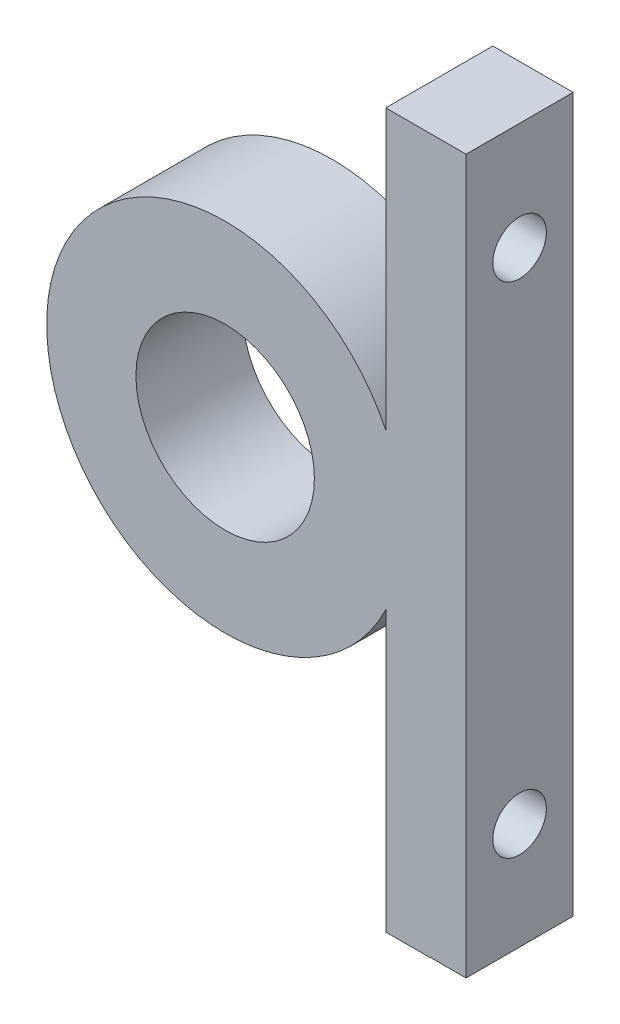
from build123d import *

# Parameters (mm, degrees)
SKETCH1_R               = 12.7
SKETCH1_R_2             = 6.35
BOSS_EXTRUDE1_DEPTH     = 7.62
CUT_EXTRUDE1_DEPTH      = 7.619999999999999
CUT_EXTRUDE1_DEPTH_BACK = 10.16
BOSS_EXTRUDE2_DEPTH     = 7.619999999999999
SKETCH5_R               = 1.905
SKETCH5_R_2             = 1.9050000000000018
CUT_EXTRUDE2_DEPTH      = 7.619999999999999


with BuildPart() as part:
    # Sketch1 → Boss-Extrude1 (new body)
    # profile 1 of 2: a face of its own
    with BuildSketch(Plane.XY):
        with Locations((-11.43, -2.615954225782393)):
            Circle(SKETCH1_R)
        with Locations((-11.43, -2.615954225782393)):
            Circle(SKETCH1_R_2, mode=Mode.SUBTRACT)
    # profile 2 of 2: a face of its own
    with BuildSketch(Plane.XY):
        Polygon((-8.7e-16, 22.784045774217606), (0, -28.01595422578239), (3.175, -28.01595422578239), (3.174999999999999, 22.784045774217606), align=None)
    extrude(amount=BOSS_EXTRUDE1_DEPTH)

    # Sketch3 → Cut-Extrude1 (cut, two sides: drawn at the far end of the back side and taken through both)
    with BuildSketch(Plane(origin=(5.715, 1e-16, 0), x_dir=(0, 0, -1), z_dir=(1, 2e-17, 0)).offset(-CUT_EXTRUDE1_DEPTH_BACK)):
        with BuildLine():
            ThreePointArc((-1.905, 15.116671425817602), (-2.4629615818396333, 16.46370984397798), (-3.810000000000017, 17.0216714258176))
            Line((-3.81, 17.0216714258176), (-3.81, 15.116671425817602))
            Line((-3.81, 15.116671425817602), (-3.81, 13.211671425817602))
            ThreePointArc((-3.8100000000000174, 13.211671425817602), (-2.4629615818396333, 13.769633007657223), (-1.905, 15.116671425817602))
        make_face()
        with BuildLine():
            Line((-3.81, 15.116671425817602), (-3.81, 17.0216714258176))
            ThreePointArc((-3.810000000000017, 17.0216714258176), (-5.715, 15.116671425817602), (-3.8100000000000174, 13.211671425817602))
            Line((-3.81, 13.211671425817602), (-3.81, 15.116671425817602))
        make_face()
        with BuildLine():
            ThreePointArc((-1.9049999999999947, -20.395954225782393), (-2.4629615818396298, -19.048915807622013), (-3.810000000000017, -18.490954225782392))
            Line((-3.81, -18.490954225782392), (-3.81, -20.395954225782393))
            Line((-3.81, -20.395954225782393), (-3.81, -22.300954225782395))
            ThreePointArc((-3.8100000000000156, -22.300954225782395), (-2.462961581839629, -21.742992643942774), (-1.9049999999999947, -20.395954225782393))
        make_face()
        with BuildLine():
            Line((-3.81, -20.395954225782393), (-3.81, -18.490954225782392))
            ThreePointArc((-3.810000000000017, -18.490954225782392), (-5.7149999999999945, -20.395954225782393), (-3.8100000000000156, -22.300954225782395))
            Line((-3.81, -22.300954225782395), (-3.81, -20.395954225782393))
        make_face()
    extrude(amount=CUT_EXTRUDE1_DEPTH + CUT_EXTRUDE1_DEPTH_BACK, mode=Mode.SUBTRACT)

    # Sketch4 → Boss-Extrude2 (add)
    with BuildSketch(Plane.XY.offset(7.62)):
        Polygon((3.174999999999999, 22.784045774217606), (5.715, 22.784045774217606), (5.715000000000006, -27.992122779019148), (3.174999999999999, -27.992122779019148), align=None)
    extrude(amount=-BOSS_EXTRUDE2_DEPTH)

    # Sketch5 → Cut-Extrude2 (cut)
    with BuildSketch(Plane(origin=(5.7150000000000025, 6.8e-16, 0), x_dir=(0, 0, -1), z_dir=(1, 1.2e-16, 0))):
        with Locations(Location((-3.81, 15.116671425817602, 0), (0, 0, 270))):
            Circle(SKETCH5_R)
        with Locations(Location((-3.8099999999999947, -20.395954225782393, 0), (0, 0, 270))):
            Circle(SKETCH5_R_2)
    extrude(amount=-CUT_EXTRUDE2_DEPTH, mode=Mode.SUBTRACT)


solid = part.part
